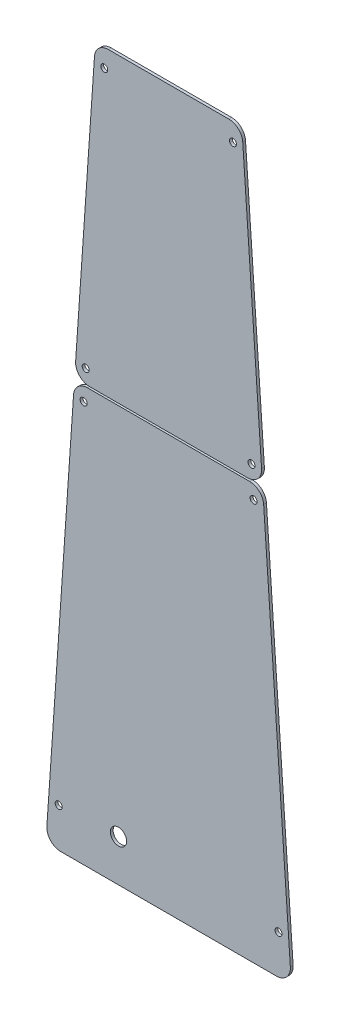
from build123d import *

# Parameters (mm, degrees)
SKETCH1_R           = 2.5
BOSS_EXTRUDE1_DEPTH = 2
FILLET1_R           = 10
SKETCH6_R           = 2.5
CUT_EXTRUDE5_DEPTH  = 10
FILLET3_R           = 10
FILLET4_R           = 10
SKETCH11_3_R        = 5.825
CUT_EXTRUDE11_DEPTH = 10


with BuildPart() as part:
    # Sketch1 → Boss-Extrude1 (new body)
    with BuildSketch(Plane.XY):
        Polygon((-88, 0), (88, 0), (52.5, 515), (-52.5, 515), align=None)
        with Locations((-78.799252079, 28.05)):
            Circle(SKETCH1_R, mode=Mode.SUBTRACT)
        with Locations((-46.128912273, 502)):
            Circle(SKETCH1_R, mode=Mode.SUBTRACT)
        with Locations((46.128912273, 502)):
            Circle(SKETCH1_R, mode=Mode.SUBTRACT)
        with Locations((78.799252079, 28.05)):
            Circle(SKETCH1_R, mode=Mode.SUBTRACT)
    extrude(amount=BOSS_EXTRUDE1_DEPTH)

    # Fillet1
    fillet1_edges = [part.edges().sort_by_distance(p)[0] for p in [
        (-88, 0, 1),
        (88, 0, 1),
        (52.5, 515, 1),
        (-52.5, 515, 1),
    ]]
    fillet(fillet1_edges, radius=FILLET1_R)

    # Sketch6 → Cut-Extrude5 (cut)
    with BuildSketch(Plane(origin=(0, 0, 0), x_dir=(-1, 0, 0), z_dir=(0, 0, -1))):
        Polygon((67.389320388, 299), (-67.389320388, 299), (-67.492718447, 297.5), (67.492718447, 297.5), align=None)
        with Locations((-60.914834604, 287.5)):
            Circle(SKETCH6_R)
        with Locations((-59.432795769, 309)):
            Circle(SKETCH6_R)
        with Locations((59.432795769, 309)):
            Circle(SKETCH6_R)
        with Locations((60.914834604, 287.5)):
            Circle(SKETCH6_R)
    extrude(amount=-CUT_EXTRUDE5_DEPTH, mode=Mode.SUBTRACT)


with BuildPart() as cut_extrude5_piece_1:
    # of the separate pieces the step leaves, piece 1, a body of its own (cut_extrude5_pieces)
    add(part.part.solids().sort_by_distance((-77.286949637, 0, 0))[0])

    # Fillet3
    fillet3_edges = [cut_extrude5_piece_1.edges().sort_by_distance(p)[0] for p in [
        (-67.492718447, 297.5, 1),
        (67.492718447, 297.5, 1),
    ]]
    fillet(fillet3_edges, radius=FILLET3_R)

    # Sketch11<3> → Cut-Extrude11 (cut)
    with BuildSketch(Plane.XY.offset(2)):
        with Locations((-35.932038835, 30)):
            Circle(SKETCH11_3_R)
    extrude(amount=-CUT_EXTRUDE11_DEPTH, mode=Mode.SUBTRACT)


with BuildPart() as cut_extrude5_piece_2:
    # of the separate pieces the step leaves, piece 2, a body of its own (cut_extrude5_pieces)
    add(part.part.solids().sort_by_distance((-53.141916618, 505.687688505, 0))[0])

    # Fillet4
    fillet4_edges = [cut_extrude5_piece_2.edges().sort_by_distance(p)[0] for p in [
        (-67.389320388, 299, 1),
        (67.389320388, 299, 1),
    ]]
    fillet(fillet4_edges, radius=FILLET4_R)


solid = Compound([cut_extrude5_piece_1.part, cut_extrude5_piece_2.part])
